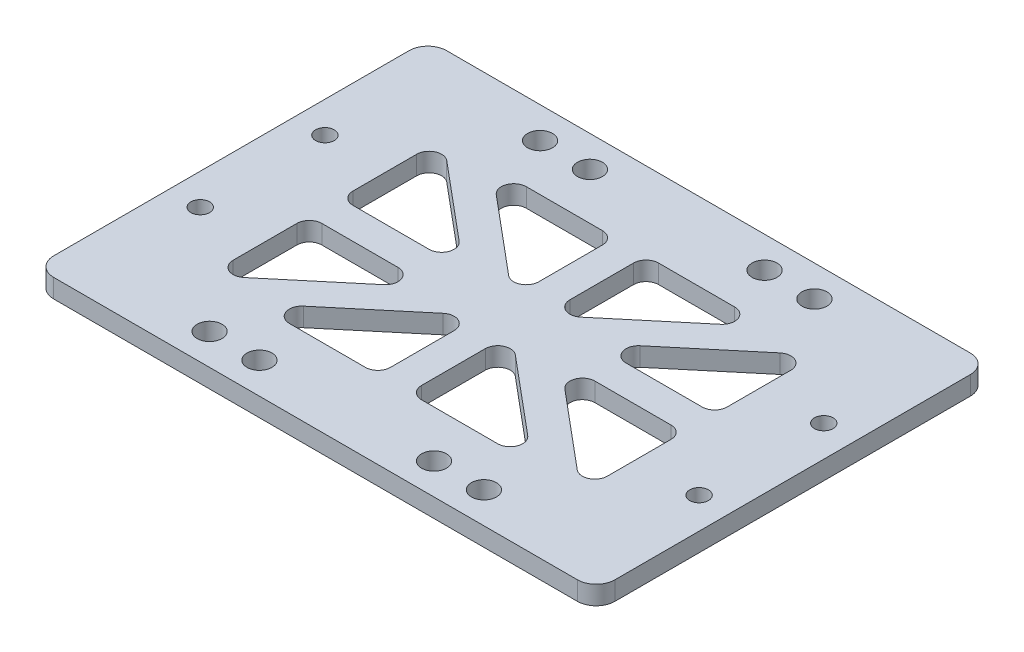
from build123d import *

# Parameters (mm, degrees)
SKETCH_1_W          = 90
SKETCH_1_H          = 63
EXTRUDE_1_DEPTH     = 3
FILLET_1_R          = 3
SKETCH_2_R          = 1.5
SKETCH_2_R_2        = 2
CUT_EXTRUDE_1_DEPTH = 10
CUT_EXTRUDE_2_DEPTH = 10


with BuildPart() as part:
    # 草图1 → 凸台-拉伸1 (new body)
    with BuildSketch(Plane(origin=(0, 0, 0), x_dir=(1, 0, 0), z_dir=(0, 1, 0))):
        Rectangle(SKETCH_1_W, SKETCH_1_H)
    extrude(amount=EXTRUDE_1_DEPTH)

    # 圆角1
    fillet_1_edges = [part.edges().sort_by_distance(p)[0] for p in [
        (45, 1.5, 31.5),
        (-45, 1.5, 31.5),
        (-45, 1.5, -31.5),
        (45, 1.5, -31.5),
    ]]
    fillet(fillet_1_edges, radius=FILLET_1_R)

    # 草图2 → 切除-拉伸1 (cut)
    with BuildSketch(Plane(origin=(0, 3, 0), x_dir=(1, 0, 0), z_dir=(0, 1, 0))):
        with Locations(Location((-40, 10, 0), (0, 0, 270))):
            Circle(SKETCH_2_R)
        with Locations(Location((-40, -10, 0), (0, 0, 270))):
            Circle(SKETCH_2_R)
        with Locations(Location((40, -10, 0), (0, 0, 270))):
            Circle(SKETCH_2_R)
        with Locations(Location((40, 10, 0), (0, 0, 270))):
            Circle(SKETCH_2_R)
        with Locations(Location((-22, -26.5, 0), (0, 0, 270))):
            Circle(SKETCH_2_R_2)
        with Locations(Location((-14, -26.5, 0), (0, 0, 270))):
            Circle(SKETCH_2_R_2)
        with Locations(Location((14, -26.5, 0), (0, 0, 270))):
            Circle(SKETCH_2_R_2)
        with Locations(Location((22, -26.5, 0), (0, 0, 270))):
            Circle(SKETCH_2_R_2)
        with Locations(Location((22, 26.5, 0), (0, 0, 270))):
            Circle(SKETCH_2_R_2)
        with Locations(Location((14, 26.5, 0), (0, 0, 270))):
            Circle(SKETCH_2_R_2)
        with Locations(Location((-14, 26.5, 0), (0, 0, 270))):
            Circle(SKETCH_2_R_2)
        with Locations(Location((-22, 26.5, 0), (0, 0, 270))):
            Circle(SKETCH_2_R_2)
    extrude(amount=-CUT_EXTRUDE_1_DEPTH, mode=Mode.SUBTRACT)

    # 草图4 → 切除-拉伸2 (cut)
    with BuildSketch(Plane(origin=(0, 3, 0), x_dir=(1, 0, 0), z_dir=(0, 1, 0))):
        with BuildLine():
            Line((16.70561704, -19), (4.5, -19))
            ThreePointArc((4.5, -19), (3.085786438, -18.414213562), (2.5, -17))
            Line((2.5, -17), (2.5, -6.782494944))
            ThreePointArc((2.5, -6.782494944), (3.653707073, -4.970372354), (5.783788282, -5.248908414))
            Line((5.783788282, -5.248908414), (17.989405322, -15.466413469))
            ThreePointArc((17.989405322, -15.466413469), (18.585400679, -17.682944704), (16.70561704, -19))
        make_face()
        with BuildLine():
            Line((14.510594678, -6.033586531), (26.716211718, -16.251091586))
            ThreePointArc((26.716211718, -16.251091586), (28.846292927, -16.529627646), (30, -14.717505056))
            Line((30, -14.717505056), (30, -4.5))
            ThreePointArc((30, -4.5), (29.414213562, -3.085786438), (28, -2.5))
            Line((28, -2.5), (15.79438296, -2.5))
            ThreePointArc((15.79438296, -2.5), (13.914599321, -3.817055296), (14.510594678, -6.033586531))
        make_face()
        with BuildLine():
            Line((28, 2.5), (15.79438296, 2.5))
            ThreePointArc((15.79438296, 2.5), (13.914599321, 3.817055296), (14.510594678, 6.033586531))
            Line((14.510594678, 6.033586531), (26.716211718, 16.251091586))
            ThreePointArc((26.716211718, 16.251091586), (28.846292927, 16.529627646), (30, 14.717505056))
            Line((30, 14.717505056), (30, 4.5))
            ThreePointArc((30, 4.5), (29.414213562, 3.085786438), (28, 2.5))
        make_face()
        with BuildLine():
            Line((5.783788282, 5.248908414), (17.989405322, 15.466413469))
            ThreePointArc((17.989405322, 15.466413469), (18.585400679, 17.682944704), (16.70561704, 19))
            Line((16.70561704, 19), (4.5, 19))
            ThreePointArc((4.5, 19), (3.085786438, 18.414213562), (2.5, 17))
            Line((2.5, 17), (2.5, 6.782494944))
            ThreePointArc((2.5, 6.782494944), (3.653707073, 4.970372354), (5.783788282, 5.248908414))
        make_face()
        with BuildLine():
            Line((-16.70561704, 19), (-4.5, 19))
            ThreePointArc((-4.5, 19), (-3.085786438, 18.414213562), (-2.5, 17))
            Line((-2.5, 17), (-2.5, 6.782494944))
            ThreePointArc((-2.5, 6.782494944), (-3.653707073, 4.970372354), (-5.783788282, 5.248908414))
            Line((-5.783788282, 5.248908414), (-17.989405322, 15.466413469))
            ThreePointArc((-17.989405322, 15.466413469), (-18.585400679, 17.682944704), (-16.70561704, 19))
        make_face()
        with BuildLine():
            Line((-14.510594678, 6.033586531), (-26.716211718, 16.251091586))
            ThreePointArc((-26.716211718, 16.251091586), (-28.846292927, 16.529627646), (-30, 14.717505056))
            Line((-30, 14.717505056), (-30, 4.5))
            ThreePointArc((-30, 4.5), (-29.414213562, 3.085786438), (-28, 2.5))
            Line((-28, 2.5), (-15.79438296, 2.5))
            ThreePointArc((-15.79438296, 2.5), (-13.914599321, 3.817055296), (-14.510594678, 6.033586531))
        make_face()
        with BuildLine():
            Line((-28, -2.5), (-15.79438296, -2.5))
            ThreePointArc((-15.79438296, -2.5), (-13.914599321, -3.817055296), (-14.510594678, -6.033586531))
            Line((-14.510594678, -6.033586531), (-26.716211718, -16.251091586))
            ThreePointArc((-26.716211718, -16.251091586), (-28.846292927, -16.529627646), (-30, -14.717505056))
            Line((-30, -14.717505056), (-30, -4.5))
            ThreePointArc((-30, -4.5), (-29.414213562, -3.085786438), (-28, -2.5))
        make_face()
        with BuildLine():
            Line((-5.783788282, -5.248908414), (-17.989405322, -15.466413469))
            ThreePointArc((-17.989405322, -15.466413469), (-18.585400679, -17.682944704), (-16.70561704, -19))
            Line((-16.70561704, -19), (-4.5, -19))
            ThreePointArc((-4.5, -19), (-3.085786438, -18.414213562), (-2.5, -17))
            Line((-2.5, -17), (-2.5, -6.782494944))
            ThreePointArc((-2.5, -6.782494944), (-3.653707073, -4.970372354), (-5.783788282, -5.248908414))
        make_face()
    extrude(amount=-CUT_EXTRUDE_2_DEPTH, mode=Mode.SUBTRACT)


solid = part.part
